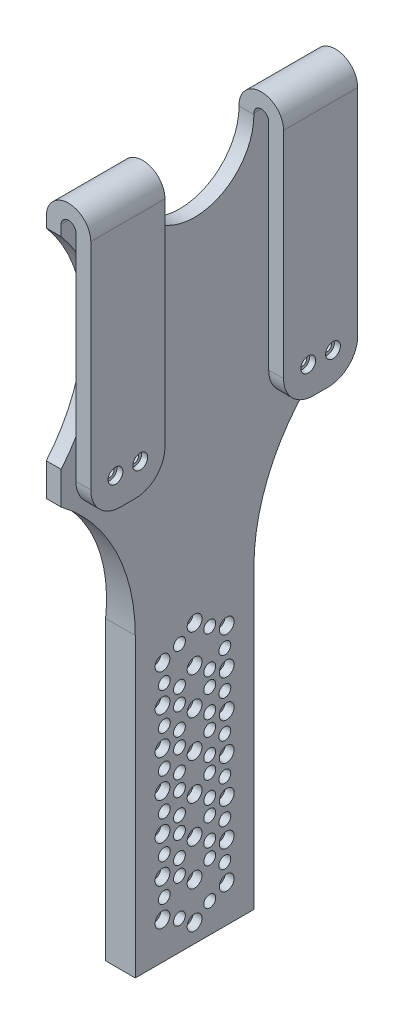
from build123d import *

# Parameters (mm, degrees)
SKETCH_1_W               = 90
SKETCH_1_H               = 90
EXTRUDE_1_DEPTH          = 15
SKETCH_2_W               = 5
SKETCH_2_H               = 82.5
CUT_EXTRUDE_1_DEPTH      = 102.734949747
CUT_EXTRUDE_2_REACH      = 67.383
SKETCH_3_W               = 40
SKETCH_3_H               = 90
FILLET_1_R               = 10
CUT_EXTRUDE_3_DEPTH      = 65.420493634
CUT_EXTRUDE_4_DEPTH      = 15
CUT_EXTRUDE_4_DEPTH_BACK = 10
SKETCH_7_R               = 1.5
CUT_EXTRUDE_5_DEPTH      = 66.383484153
SKETCH_8_R               = 2.5
CUT_EXTRUDE_6_DEPTH      = 2
EXTRUDE_2_DEPTH          = 45
EXTRUDE_2_DEPTH_BACK     = 45
SKETCH_10_R              = 1.5
CUT_EXTRUDE_7_DEPTH      = 50
SKETCH_11_R              = 2
CUT_EXTRUDE_8_DEPTH      = 50
SKETCH_13_R              = 2.5
CUT_EXTRUDE_9_DEPTH      = 3
PATTERN_LINEAR_3_COUNT   = 6
PATTERN_LINEAR_3_PITCH   = 12.5
CUT_EXTRUDE_10_DEPTH     = 202.121853611


with BuildPart() as part:
    # 草图1 → 凸台-拉伸1 (new body)
    with BuildSketch(Plane(origin=(0, 0, 0), x_dir=(0, 0, -1), z_dir=(1, 0, 0))):
        Rectangle(SKETCH_1_W, SKETCH_1_H)
    extrude(amount=EXTRUDE_1_DEPTH)

    # 草图2 → 切除-拉伸1 (cut, through all)
    with BuildSketch(Plane.XY.offset(45)):
        with BuildLine():
            Line((0, 45), (0, 37.5))
            ThreePointArc((0, 37.5), (2.196699141, 42.803300859), (7.5, 45))
            Line((7.5, 45), (0, 45))
        make_face()
        with BuildLine():
            Line((15, 45), (7.5, 45))
            ThreePointArc((7.5, 45), (12.803300859, 42.803300859), (15, 37.5))
            Line((15, 37.5), (15, 45))
        make_face()
        with BuildLine():
            ThreePointArc((10, 37.5), (7.5, 40), (5, 37.5))
            Line((5, 37.5), (10, 37.5))
        make_face()
        with Locations((7.5, -3.75)):
            Rectangle(SKETCH_2_W, SKETCH_2_H)
    extrude(amount=-CUT_EXTRUDE_1_DEPTH, mode=Mode.SUBTRACT)

    # 切除-拉伸2: up to this face of the body (flat: up to its plane)
    cut_extrude_2_end = Plane(part.part.faces().sort_by_distance((5, -3.75, 0))[0])
    # 草图3 → 切除-拉伸2 (cut, up to the picked face)
    with BuildSketch(Plane(origin=(15, 0, 0), x_dir=(0, 0, -1), z_dir=(1, 0, 0)), mode=Mode.PRIVATE) as cut_extrude_2_sk1:
        Rectangle(SKETCH_3_W, SKETCH_3_H)
    cut_extrude_2_tool1 = split(extrude(cut_extrude_2_sk1.sketch, amount=-CUT_EXTRUDE_2_REACH, mode=Mode.PRIVATE), bisect_by=cut_extrude_2_end, keep=Keep.BOTH, mode=Mode.PRIVATE)
    add(cut_extrude_2_tool1.solids().sort_by(Axis((15, 0, 0), (-1, 0, 0)))[0], mode=Mode.SUBTRACT)

    # 圆角1
    fillet_1_edges = [part.edges().sort_by_distance(p)[0] for p in [
        (12.5, -45, 20),
        (12.5, -45, -20),
        (12.5, -45, -45),
        (12.5, -45, 45),
    ]]
    fillet(fillet_1_edges, radius=FILLET_1_R)

    # 草图4 → 切除-拉伸3 (cut, through all)
    with BuildSketch(Plane(origin=(5, 0, 0), x_dir=(0, 0, -1), z_dir=(1, 0, 0))):
        with BuildLine():
            Line((-20, 44.571067812), (-20, 37.104465858))
            ThreePointArc((-20, 37.104465858), (0, 17.104465858), (20, 37.104465858))
            Line((20, 37.104465858), (20, 44.571067812))
            Line((20, 44.571067812), (-20, 44.571067812))
        make_face()
    extrude(amount=-CUT_EXTRUDE_3_DEPTH, mode=Mode.SUBTRACT)

    # 草图6 → 切除-拉伸4 (cut, two sides: drawn at the far end of the back side and taken through both)
    with BuildSketch(Plane.ZY.offset(-CUT_EXTRUDE_4_DEPTH_BACK)):
        with BuildLine():
            Line((45, 33.969795549), (45, -33.969795549))
            ThreePointArc((45, -33.969795549), (32.5, 0), (45, 33.969795549))
        make_face()
        with BuildLine():
            Line((-45, 33.969795549), (-45, -33.969795549))
            ThreePointArc((-45, -33.969795549), (-32.5, 0), (-45, 33.969795549))
        make_face()
    extrude(amount=CUT_EXTRUDE_4_DEPTH + CUT_EXTRUDE_4_DEPTH_BACK, mode=Mode.SUBTRACT)

    # 草图7 → 切除-拉伸5 (cut, through all)
    with BuildSketch(Plane(origin=(15, 0, 0), x_dir=(0, 0, -1), z_dir=(1, 0, 0))):
        with Locations((-36.666666667, -35)):
            Circle(SKETCH_7_R)
        with Locations(Location((-28.333333333, -35, 0), (0, 0, 270))):
            Circle(SKETCH_7_R)
        with Locations(Location((36.666666667, -35, 0), (0, 0, 270))):
            Circle(SKETCH_7_R)
        with Locations((28.333333333, -35)):
            Circle(SKETCH_7_R)
    extrude(amount=-CUT_EXTRUDE_5_DEPTH, mode=Mode.SUBTRACT)

    # 草图8 → 切除-拉伸6 (cut)
    with BuildSketch(Plane(origin=(15, 0, 0), x_dir=(0, 0, -1), z_dir=(1, 0, 0))):
        with Locations((-36.666666667, -35)):
            Circle(SKETCH_8_R)
        with Locations((-28.333333333, -35)):
            Circle(SKETCH_8_R)
        with Locations((28.333333333, -35)):
            Circle(SKETCH_8_R)
        with Locations((36.666666667, -35)):
            Circle(SKETCH_8_R)
    extrude(amount=-CUT_EXTRUDE_6_DEPTH, mode=Mode.SUBTRACT)

    # 草图9 → 凸台-拉伸2 (add, two sides: drawn at the far end of the back side and taken through both)
    with BuildSketch(Plane.XY.offset(-EXTRUDE_2_DEPTH_BACK)):
        Polygon((0, -45), (5, -45), (5, -195), (-5, -195), (-5, -95), align=None)
    extrude(amount=EXTRUDE_2_DEPTH + EXTRUDE_2_DEPTH_BACK)

    # 草图10 → 切除-拉伸7 (cut)
    with BuildSketch(Plane.ZY.offset(5)):
        with Locations((0, -163.767347597)):
            Circle(SKETCH_10_R)
        with Locations((0, -188.767347597)):
            Circle(SKETCH_10_R)
        with Locations((-10.825317547, -170.017347597)):
            Circle(SKETCH_10_R)
        with Locations(Location((-10.825317547, -182.517347597, 0), (0, 0, 90))):
            Circle(SKETCH_10_R)
        with Locations((10.825317547, -182.517347597)):
            Circle(SKETCH_10_R)
        with Locations(Location((10.825317547, -170.017347597, 0), (0, 0, 90))):
            Circle(SKETCH_10_R)
    cut_extrude_7 = extrude(amount=-CUT_EXTRUDE_7_DEPTH, mode=Mode.SUBTRACT)

    # 草图11 → 切除-拉伸8 (cut)
    with BuildSketch(Plane.ZY.offset(5)):
        with Locations((-5.1, -167.433888479)):
            Circle(SKETCH_11_R)
        with Locations((10.2, -176.267347597)):
            Circle(SKETCH_11_R)
        with Locations((5.1, -167.433888479)):
            Circle(SKETCH_11_R)
        with Locations(Location((5.1, -185.100806716, 0), (0, 0, 90))):
            Circle(SKETCH_11_R)
        with Locations(Location((-5.1, -185.100806716, 0), (0, 0, 90))):
            Circle(SKETCH_11_R)
        with Locations(Location((-10.2, -176.267347597, 0), (0, 0, 90))):
            Circle(SKETCH_11_R)
    cut_extrude_8 = extrude(amount=-CUT_EXTRUDE_8_DEPTH, mode=Mode.SUBTRACT)

    # 草图13 → 切除-拉伸9 (cut)
    with BuildSketch(Plane.ZY.offset(-5)):
        with Locations(Location((0, -163.767347597, 0), (0, 0, 270))):
            Circle(SKETCH_13_R)
        with Locations(Location((10.825317547, -170.017347597, 0), (0, 0, 270))):
            Circle(SKETCH_13_R)
        with Locations(Location((10.825317547, -182.517347597, 0), (0, 0, 270))):
            Circle(SKETCH_13_R)
        with Locations(Location((0, -188.767347597, 0), (0, 0, 270))):
            Circle(SKETCH_13_R)
        with Locations(Location((-10.825317547, -182.517347597, 0), (0, 0, 270))):
            Circle(SKETCH_13_R)
        with Locations(Location((-10.825317547, -170.017347597, 0), (0, 0, 270))):
            Circle(SKETCH_13_R)
    cut_extrude_9 = extrude(amount=CUT_EXTRUDE_9_DEPTH, mode=Mode.SUBTRACT)

    # 阵列(线性)3: 切除-拉伸7, 切除-拉伸8, 切除-拉伸9 ×6
    with Locations(*[(0, i * PATTERN_LINEAR_3_PITCH, 0) for i in range(1, PATTERN_LINEAR_3_COUNT)]):
        add(cut_extrude_7, mode=Mode.SUBTRACT)
        add(cut_extrude_8, mode=Mode.SUBTRACT)
        add(cut_extrude_9, mode=Mode.SUBTRACT)

    # 草图14 → 切除-拉伸10 (cut, through all)
    with BuildSketch(Plane.ZY.offset(5)):
        with BuildLine():
            Line((-20, -195), (-20, -95))
            ThreePointArc((-20, -95), (-26.598300563, -67.049150281), (-45, -45))
            Line((-45, -45), (-45, -195))
            Line((-45, -195), (-20, -195))
        make_face()
        with BuildLine():
            Line((45, -195), (20, -195))
            Line((20, -195), (20, -95))
            ThreePointArc((20, -95), (26.598300563, -67.049150281), (45, -45))
            Line((45, -45), (45, -195))
        make_face()
    extrude(amount=-CUT_EXTRUDE_10_DEPTH, mode=Mode.SUBTRACT)


solid = part.part
